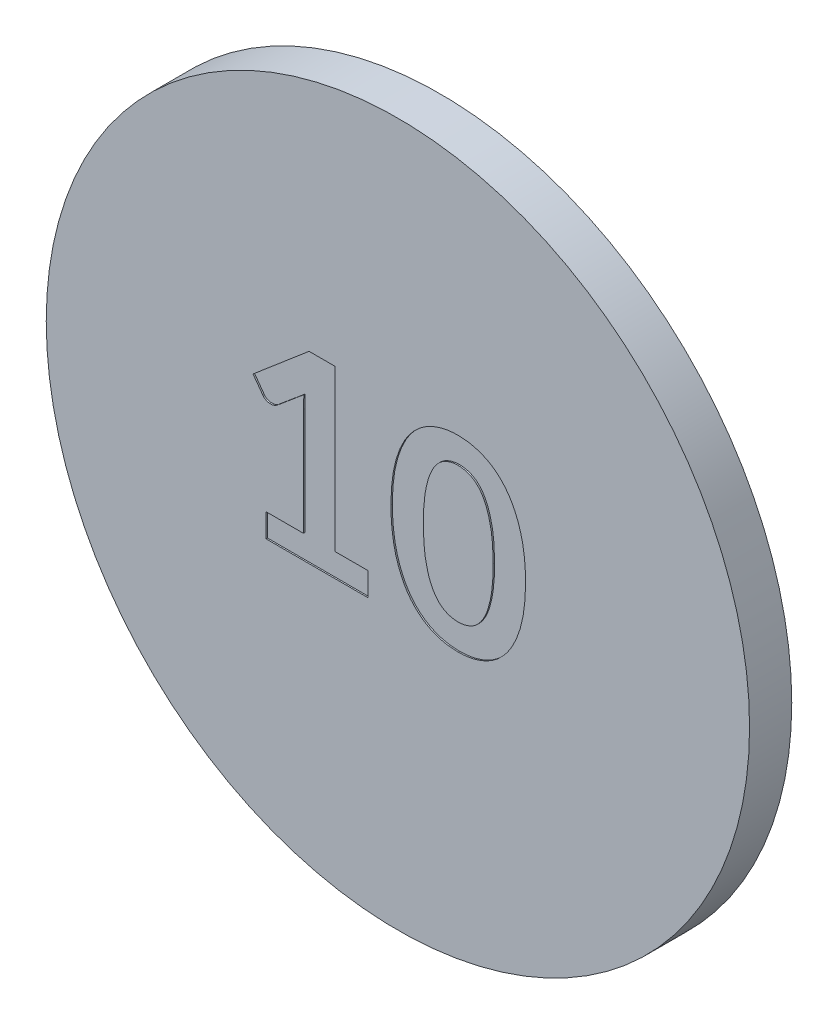
from build123d import *

# Parameters (mm, degrees)
SKETCH1_R           = 25
BOSS_EXTRUDE1_DEPTH = 3
CUT_EXTRUDE1_DEPTH  = 0.1


with BuildPart() as part:
    # Sketch1 → Boss-Extrude1 (new body)
    with BuildSketch(Plane(origin=(0, 0, 0), x_dir=(0, 1, 0), z_dir=(0, 0, 1))):
        with Locations(Location((0, 0, 0), (0, 0, 270))):
            Circle(SKETCH1_R)
    extrude(amount=BOSS_EXTRUDE1_DEPTH)

    # Sketch3 → Cut-Extrude1 (cut)
    # profile 1 of 2: a face of its own
    with BuildSketch(Plane.XY.offset(3)):
        with BuildLine():
            Line((-2.135536589, -3.91952773), (-2.135536589, -5.589026656))
            Line((-2.135536589, -5.589026656), (-9.359581237, -5.589026656))
            Line((-9.359581237, -5.589026656), (-9.359581237, -3.91952773))
            Line((-9.359581237, -3.91952773), (-6.712942094, -3.91952773))
            Line((-6.712942094, -3.91952773), (-6.712942094, 3.6938054))
            add(Edge.make_bspline(
                [(-6.712942094, 3.6938054), (-6.711155885, 3.847105408), (-6.707541754, 4.157285237), (-6.693777105, 4.467181218), (-6.686815351, 4.623917478)],
                knots=[0, 0, 0, 0, 0.98845891, 2, 2, 2, 2], degree=3))
            Line((-6.686815351, 4.623917478), (-8.565328227, 3.051087504))
            add(Edge.make_bspline(
                [(-8.565328227, 3.051087504), (-8.617759942, 3.014331802), (-8.716372329, 2.945202508), (-8.880339811, 2.88896631), (-9.036125684, 2.875345654), (-9.18237461, 2.882130045), (-9.313965386, 2.925554364), (-9.431240682, 2.977107644), (-9.527057416, 3.04704147), (-9.573128253, 3.104942057), (-9.594721931, 3.132080409)],
                knots=[0, 0, 0, 0, 1.335478134, 2.511737127, 3.574879376, 4.598514131, 5.550291057, 6.455707661, 7.276180923, 8, 8, 8, 8], degree=3))
            Line((-9.594721931, 3.132080409), (-10.297531338, 4.098769928))
            Line((-10.297531338, 4.098769928), (-6.315815589, 7.484795919))
            Line((-6.315815589, 7.484795919), (-4.484330852, 7.484795919))
            Line((-4.484330852, 7.484795919), (-4.484330852, -3.91952773))
            Line((-4.484330852, -3.91952773), (-2.135536589, -3.91952773))
        make_face()
    # profile 2 of 2: a face of its own
    with BuildSketch(Plane.XY.offset(3)):
        with BuildLine():
            add(Edge.make_bspline(
                [(9.075449156, 0.940046608), (9.071019121, 0.664701426), (9.062453061, 0.132285105), (8.994417033, -0.639500558), (8.881176325, -1.355733726), (8.722500681, -2.017311728), (8.521457839, -2.6215582), (8.285804124, -3.171554325), (8.017952132, -3.668932341), (7.711163277, -4.110013082), (7.372230822, -4.49674732), (7.00440566, -4.832496752), (6.604657821, -5.113627074), (6.176960126, -5.341859495), (5.726135225, -5.515862981), (5.257991212, -5.64302657), (4.771230439, -5.71676622), (4.440808731, -5.727356618), (4.273353654, -5.732723747)],
                knots=[0, 0, 0, 0, 1.427761042, 2.760764776, 4.014112494, 5.185114878, 6.284837347, 7.312563931, 8.284692091, 9.209319466, 10.092619187, 10.946314317, 11.785842449, 12.620313761, 13.453990262, 14.286626251, 15.131675901, 16, 16, 16, 16], degree=3))
            add(Edge.make_bspline(
                [(4.273353654, -5.732723747), (4.105903463, -5.727337226), (3.775491393, -5.716708563), (3.28949381, -5.643374433), (2.823176442, -5.515750192), (2.375519546, -5.342384412), (1.952183128, -5.113690706), (1.557547903, -4.830750182), (1.190020452, -4.497705935), (0.853943156, -4.109729476), (0.54959844, -3.66884397), (0.284444452, -3.171414662), (0.051406307, -2.621436329), (-0.146966158, -2.017182795), (-0.303219138, -1.355635346), (-0.412983668, -0.639255268), (-0.481995779, 0.132254791), (-0.490420263, 0.664691092), (-0.494777081, 0.940046608)],
                knots=[0, 0, 0, 0, 0.870312425, 1.717297107, 2.547469919, 3.378839009, 4.207245088, 5.041308741, 5.896958699, 6.779301806, 7.703466893, 8.675663034, 9.703960984, 10.804778541, 11.977405589, 13.232913505, 14.568969609, 16, 16, 16, 16], degree=3))
            add(Edge.make_bspline(
                [(-0.494777081, 0.940046608), (-0.490395372, 1.216269227), (-0.48192189, 1.750436948), (-0.413378742, 2.522881329), (-0.303182258, 3.238353368), (-0.14706114, 3.897338419), (0.051897585, 4.499634222), (0.284526412, 5.048825866), (0.54881735, 5.545984912), (0.854669604, 5.98502091), (1.190812097, 6.372527453), (1.556644922, 6.708377286), (1.952311151, 6.990983264), (2.375424524, 7.220136663), (2.823644607, 7.392411155), (3.289018042, 7.524330183), (3.775555765, 7.59656853), (4.105925113, 7.607351991), (4.273353654, 7.612816963)],
                knots=[0, 0, 0, 0, 1.435879915, 2.776748353, 4.028067345, 5.196555383, 6.293321804, 7.321852275, 8.294268251, 9.214920023, 10.097462647, 10.956354759, 11.790607013, 12.619200412, 13.450757493, 14.282314574, 15.129490778, 16, 16, 16, 16], degree=3))
            add(Edge.make_bspline(
                [(4.273353654, 7.612816963), (4.440787348, 7.607371921), (4.771166865, 7.596627784), (5.258463213, 7.523978149), (5.725669157, 7.392522252), (6.177055392, 7.219613418), (6.60452845, 6.990917769), (7.005314836, 6.710131059), (7.371436101, 6.371566293), (7.710433994, 5.985297187), (8.018735703, 5.546079999), (8.285722605, 5.048964987), (8.520961624, 4.499752358), (8.722595975, 3.897468449), (8.881140026, 3.238452128), (8.994817843, 2.52312835), (9.06237705, 1.750406214), (9.070993512, 1.216258751), (9.075449156, 0.940046608)],
                knots=[0, 0, 0, 0, 0.868519118, 1.713758561, 2.547769124, 3.381632863, 4.216291591, 5.056008275, 5.912936842, 6.796434946, 7.717566584, 8.689913077, 9.717870481, 10.813555276, 11.980430531, 13.229599676, 14.567402704, 16, 16, 16, 16], degree=3))
        make_face()
        with BuildLine():
            add(Edge.make_bspline(
                [(6.773683032, 0.940046608), (6.77138159, 1.165667325), (6.766970374, 1.598118622), (6.728307454, 2.215549989), (6.664537347, 2.773177449), (6.573734771, 3.271486255), (6.459730373, 3.715657268), (6.335426284, 4.112484148), (6.184804403, 4.459488084), (6.021296706, 4.762466776), (5.841121054, 5.020853425), (5.645543659, 5.235343664), (5.438884475, 5.411292967), (5.216254332, 5.542223154), (4.986608258, 5.638348235), (4.753221726, 5.71009288), (4.514460938, 5.753355227), (4.353647187, 5.758074514), (4.273353654, 5.760430831)],
                knots=[0, 0, 0, 0, 1.791502552, 3.433805244, 4.910094652, 6.246187574, 7.452181068, 8.550059512, 9.544407747, 10.451236363, 11.280112373, 12.038857448, 12.750772576, 13.426816362, 14.080634448, 14.723832631, 15.362815766, 16, 16, 16, 16], degree=3))
            add(Edge.make_bspline(
                [(4.273353654, 5.760430831), (4.193929125, 5.758074214), (4.034841366, 5.753353899), (3.79867417, 5.710082057), (3.567895178, 5.638325997), (3.34083945, 5.542172118), (3.120806553, 5.411186913), (2.916795755, 5.235215966), (2.723856864, 5.020694951), (2.546375935, 4.762292593), (2.385287867, 4.459402243), (2.238157676, 4.111833538), (2.112289385, 3.71612128), (2.002158784, 3.271274037), (1.913387308, 2.773117016), (1.853202684, 2.215358755), (1.813457884, 1.598145015), (1.809206893, 1.165676374), (1.806989044, 0.940046608)],
                knots=[0, 0, 0, 0, 0.632503036, 1.266906969, 1.905736897, 2.555481396, 3.22795667, 3.937072042, 4.693831014, 5.521656093, 6.428370863, 7.423497167, 8.525249946, 9.733806716, 11.073374713, 12.554077104, 14.202175365, 16, 16, 16, 16], degree=3))
            add(Edge.make_bspline(
                [(1.806989044, 0.940046608), (1.809150434, 0.713542452), (1.813277296, 0.281065434), (1.853525525, -0.336977132), (1.913149895, -0.894791395), (2.002172463, -1.393796121), (2.112305148, -1.838626066), (2.238092594, -2.234402012), (2.385500536, -2.581763606), (2.545349233, -2.884693439), (2.725631944, -3.140918115), (2.915791122, -3.357748528), (3.120931921, -3.533598875), (3.340807832, -3.664718687), (3.56790337, -3.760838431), (3.798672018, -3.832603361), (4.034841901, -3.875872898), (4.193929303, -3.88059352), (4.273353654, -3.882950289)],
                knots=[0, 0, 0, 0, 1.804043418, 3.444560704, 4.931565859, 6.27059941, 7.478674004, 8.579987218, 9.574716498, 10.481069517, 11.302874194, 12.064498727, 12.773331185, 13.445538162, 14.095023433, 14.733598488, 15.367749313, 16, 16, 16, 16], degree=3))
            add(Edge.make_bspline(
                [(4.273353654, -3.882950289), (4.353647007, -3.880593815), (4.514460398, -3.875874216), (4.753223901, -3.832614228), (4.986599988, -3.760860505), (5.21628622, -3.664770329), (5.438758244, -3.533702706), (5.646550427, -3.357890125), (5.839340697, -3.14105262), (6.022326866, -2.884880989), (6.184591644, -2.581847144), (6.335491123, -2.235053157), (6.459714851, -1.838161923), (6.573720226, -1.394008202), (6.664781663, -0.894853631), (6.727975633, -0.337166314), (6.767152111, 0.281091524), (6.771438232, 0.713551419), (6.773683032, 0.940046608)],
                knots=[0, 0, 0, 0, 0.636931218, 1.275660623, 1.918603401, 2.572161866, 3.247937206, 3.959569644, 4.723131429, 5.546035468, 6.452503996, 7.44645739, 8.543899885, 9.749414497, 11.084976877, 12.567545687, 14.202297145, 16, 16, 16, 16], degree=3))
        make_face(mode=Mode.SUBTRACT)
    extrude(amount=-CUT_EXTRUDE1_DEPTH, mode=Mode.SUBTRACT)


solid = part.part
